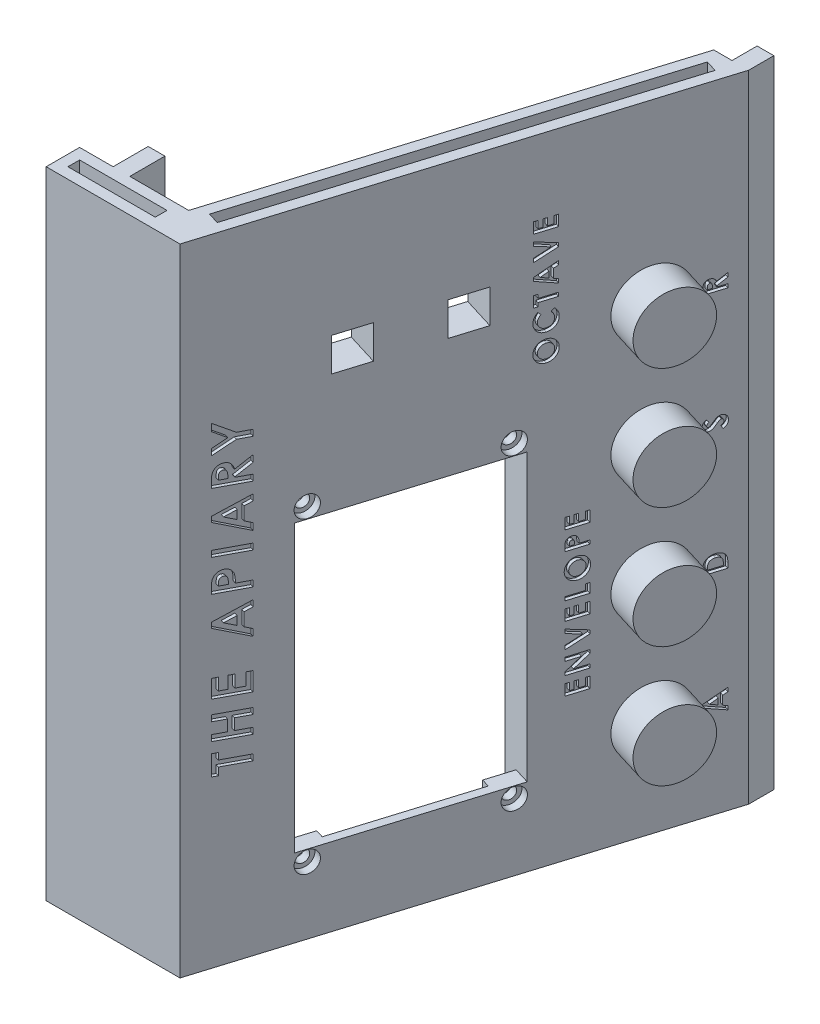
from build123d import *

# Parameters (mm, degrees)
BOSS_EXTRUDE1_DEPTH  = 190
SKETCH3_W            = 5
SKETCH3_H            = 10.5
BOSS_EXTRUDE4_DEPTH  = 190
SKETCH6_W            = 26.114253455
SKETCH6_H            = 3.5
CUT_EXTRUDE1_DEPTH   = 10
SKETCH5_W            = 98.2
SKETCH5_H            = 55.7
SKETCH5_W_2          = 98
SKETCH5_H_2          = 55.5
CUT_EXTRUDE2_DEPTH   = 5
CUT_EXTRUDE3_REACH   = 253.593
SKETCH7_R            = 1.9
LPATTERN1_COUNT      = 2
LPATTERN1_PITCH      = 92
LPATTERN1_COUNT_DIR2 = 2
LPATTERN1_PITCH_DIR2 = 49.5
CUT_EXTRUDE5_REACH   = 253.593
SKETCH9_W            = 85.4
SKETCH9_H            = 55.7
SKETCH8_W            = 6.4
SKETCH8_H            = 39.7
CUT_EXTRUDE4_DEPTH   = 2.5
SKETCH10_R           = 3.15
CUT_EXTRUDE6_DEPTH   = 2.5
LPATTERN2_COUNT      = 2
LPATTERN2_PITCH      = 92
LPATTERN2_COUNT_DIR2 = 2
LPATTERN2_PITCH_DIR2 = 49.5
CUT_EXTRUDE7_REACH   = 254.302
SKETCH11_R           = 3.35
SKETCH16_R           = 10
BOSS_EXTRUDE5_DEPTH  = 10
LPATTERN3_COUNT      = 4
LPATTERN3_PITCH      = 36.020833333
CUT_EXTRUDE9_REACH   = 254.302
SKETCH15_W           = 10
SKETCH15_H           = 10
CUT_EXTRUDE8_DEPTH   = 1


with BuildPart() as part:
    # Sketch1 → Boss-Extrude1 (new body)
    with BuildSketch(Plane(origin=(0, 0, 0), x_dir=(-1, 0, 0), z_dir=(0, 1, 0))):
        Polygon((-5.311906236, 16.03215452), (-10.311906236, 17.570616058), (-10.311906236, 10.070616058), (-5.311906236, 10.070616058), align=None)
        Polygon((-5.311906236, 17.570616058), (-10.311906236, 17.570616058), (-5.311906236, 16.03215452), align=None)
        Polygon((29.688093764, 147.570616058), (-10.311906236, 17.570616058), (-5.311906236, 17.570616058), (0.150763386, 17.570616058), (37.073840309, 137.570616058), (29.688093764, 137.570616058), align=None)
        Polygon((69.688093764, 147.570616058), (29.688093764, 147.570616058), (39.245883851, 144.62975757), (37.073840309, 137.570616058), (69.688093764, 137.570616058), align=None)
        Polygon((39.245883851, 144.62975757), (29.688093764, 147.570616058), (29.688093764, 137.570616058), (37.073840309, 137.570616058), align=None)
    extrude(amount=BOSS_EXTRUDE1_DEPTH)

    # Sketch3 → Boss-Extrude4 (add)
    with BuildSketch(Plane(origin=(0, 190, 0), x_dir=(-1, 0, 0), z_dir=(0, 1, 0))):
        with Locations((57.188093764, 132.320616058)):
            Rectangle(SKETCH3_W, SKETCH3_H)
    extrude(amount=-BOSS_EXTRUDE4_DEPTH)

    # Sketch6 → Cut-Extrude1 (cut)
    with BuildSketch(Plane(origin=(0, 190, 0), x_dir=(-1, 0, 0), z_dir=(0, 1, 0))):
        Polygon((33.011779522, 135.420113289), (-1.999739384, 21.632676846), (-5.344965914, 22.661977316), (29.666552992, 136.44941376), align=None)
        with Locations((53.380967037, 142.570616058)):
            Rectangle(SKETCH6_W, SKETCH6_H)
    cut_extrude1 = extrude(amount=-CUT_EXTRUDE1_DEPTH, mode=Mode.SUBTRACT)

    # Mirror1: Cut-Extrude1 across plane
    add(cut_extrude1.mirror(Plane.ZX.offset(95)), mode=Mode.SUBTRACT)

    # Sketch5 → Cut-Extrude2 (cut)
    # profile 1 of 2: a face of its own
    with BuildSketch(Plane(origin=(4.801043367, 0, 1.477244113), x_dir=(0, -1, 0), z_dir=(-0.9557790087219502, 0, -0.2940858488375231))):
        with Locations((-66, 94.587963377)):
            Rectangle(SKETCH5_W, SKETCH5_H)
        with Locations((-66, 94.587963377)):
            Rectangle(SKETCH5_W_2, SKETCH5_H_2, mode=Mode.SUBTRACT)
    # profile 2 of 2: a face of its own
    with BuildSketch(Plane(origin=(4.801043367, 0, 1.477244113), x_dir=(0, -1, 0), z_dir=(-0.9557790087219502, 0, -0.2940858488375231))):
        with Locations((-66, 94.587963377)):
            Rectangle(SKETCH5_W_2, SKETCH5_H_2)
    extrude(amount=-CUT_EXTRUDE2_DEPTH, mode=Mode.SUBTRACT)

    # Sketch7 → Cut-Extrude3 (cut, up to next)
    with BuildSketch(Plane(origin=(9.57993841, 0, 2.947673357), x_dir=(0, -1, 0), z_dir=(-0.9557790087219502, 0, -0.2940858488375231)), mode=Mode.PRIVATE) as cut_extrude3_sk1:
        with Locations(Location((-112, 119.337963377, 0), (0, 0, 90))):
            Circle(SKETCH7_R)
    cut_extrude3_tool1 = extrude(cut_extrude3_sk1.sketch, amount=-CUT_EXTRUDE3_REACH, mode=Mode.PRIVATE) & part.part
    cut_extrude3 = cut_extrude3_tool1.solids().sort_by_distance((-25.515668, 112, 117.008394))[0]
    add(cut_extrude3, mode=Mode.SUBTRACT)

    # LPattern1: Cut-Extrude3 2 × 2
    with Locations(*[Vector(0, -1, 0) * (i * LPATTERN1_PITCH) + Vector(0.29408584883752303, 0, -0.9557790087219501) * (j * LPATTERN1_PITCH_DIR2) for i in range(LPATTERN1_COUNT) for j in range(LPATTERN1_COUNT_DIR2) if (i, j) != (0, 0)]):
        add(cut_extrude3, mode=Mode.SUBTRACT)

    # Sketch9 → Cut-Extrude5 (cut, up to next)
    with BuildSketch(Plane(origin=(9.57993841, 0, 2.947673357), x_dir=(0, -1, 0), z_dir=(-0.9557790087219502, 0, -0.2940858488375231)), mode=Mode.PRIVATE) as cut_extrude5_sk1:
        with Locations((-66, 94.587963377)):
            Rectangle(SKETCH9_W, SKETCH9_H)
    cut_extrude5_tool1 = extrude(cut_extrude5_sk1.sketch, amount=-CUT_EXTRUDE5_REACH, mode=Mode.PRIVATE) & part.part
    add(cut_extrude5_tool1.solids().sort_by_distance((-18.237043, 66, 93.352863))[0], mode=Mode.SUBTRACT)

    # Sketch8 → Cut-Extrude4 (cut)
    with BuildSketch(Plane(origin=(9.57993841, 0, 2.947673357), x_dir=(0, -1, 0), z_dir=(-0.9557790087219502, 0, -0.2940858488375231))):
        with Locations((-20.1, 94.587963377)):
            Rectangle(SKETCH8_W, SKETCH8_H)
    extrude(amount=-CUT_EXTRUDE4_DEPTH, mode=Mode.SUBTRACT)

    # Sketch10 → Cut-Extrude6 (cut)
    with BuildSketch(Plane(origin=(14.358833454, 0, 4.418102601), x_dir=(0, 1, 0), z_dir=(0.9557790087219502, 0, 0.29408584883752303))):
        with Locations(Location((20, 119.337963377, 0), (0, 0, 270))):
            Circle(SKETCH10_R)
    cut_extrude6 = extrude(amount=-CUT_EXTRUDE6_DEPTH, mode=Mode.SUBTRACT)

    # LPattern2: Cut-Extrude6 2 × 2
    with Locations(*[Vector(0, 1, 0) * (i * LPATTERN2_PITCH) + Vector(0.29408584883752303, 0, -0.9557790087219502) * (j * LPATTERN2_PITCH_DIR2) for i in range(LPATTERN2_COUNT) for j in range(LPATTERN2_COUNT_DIR2) if (i, j) != (0, 0)]):
        add(cut_extrude6, mode=Mode.SUBTRACT)

    # Sketch11 → Cut-Extrude7 (cut, up to next)
    with BuildSketch(Plane(origin=(14.358833454, 0, 4.418102601), x_dir=(0, 1, 0), z_dir=(0.9557790087219502, 0, 0.29408584883752303)), mode=Mode.PRIVATE) as cut_extrude7_sk1:
        with Locations(Location((29.09375, 36.737963377, 0), (0, 0, 270))):
            Circle(SKETCH11_R)
    cut_extrude7_tool1 = extrude(cut_extrude7_sk1.sketch, amount=-CUT_EXTRUDE7_REACH, mode=Mode.PRIVATE) & part.part
    cut_extrude7 = cut_extrude7_tool1.solids().sort_by_distance((3.554718, 29.09375, 39.531477))[0]
    add(cut_extrude7, mode=Mode.SUBTRACT)

    # Sketch16 → Boss-Extrude5 (add)
    with BuildSketch(Plane(origin=(14.358833454, 0, 4.418102601), x_dir=(0, 1, 0), z_dir=(0.9557790087219502, 0, 0.2940858488375231))):
        with Locations(Location((29.09375, 36.737963377, 0), (0, 0, 270))):
            Circle(SKETCH16_R)
    boss_extrude5 = extrude(amount=BOSS_EXTRUDE5_DEPTH)

    # LPattern3: Cut-Extrude7, Boss-Extrude5 ×4
    with Locations(*[(0, i * LPATTERN3_PITCH, 0) for i in range(1, LPATTERN3_COUNT)]):
        add(cut_extrude7, mode=Mode.SUBTRACT)
        add(boss_extrude5)

    # Sketch15 → Cut-Extrude9 (cut, up to next)
    with BuildSketch(Plane(origin=(14.358833454, 0, 4.418102601), x_dir=(0, 1, 0), z_dir=(0.9557790087219502, 0, 0.2940858488375231)), mode=Mode.PRIVATE) as cut_extrude9_sk1:
        with Locations((149.35, 108.512963377)):
            Rectangle(SKETCH15_W, SKETCH15_H)
    cut_extrude9_tool1 = extrude(cut_extrude9_sk1.sketch, amount=-CUT_EXTRUDE9_REACH, mode=Mode.PRIVATE) & part.part
    # Sketch15 → Cut-Extrude9 (cut, up to next)
    with BuildSketch(Plane(origin=(14.358833454, 0, 4.418102601), x_dir=(0, 1, 0), z_dir=(0.9557790087219502, 0, 0.2940858488375231)), mode=Mode.PRIVATE) as cut_extrude9_sk2:
        with Locations((149.35, 80.662963377)):
            Rectangle(SKETCH15_W, SKETCH15_H)
    cut_extrude9_tool2 = extrude(cut_extrude9_sk2.sketch, amount=-CUT_EXTRUDE9_REACH, mode=Mode.PRIVATE) & part.part
    add(cut_extrude9_tool1.solids().sort_by_distance((-17.553293, 149.35, 108.132515))[0], mode=Mode.SUBTRACT)
    add(cut_extrude9_tool2.solids().sort_by_distance((-9.363003, 149.35, 81.51407))[0], mode=Mode.SUBTRACT)

    # Sketch13 → Cut-Extrude8 (cut)
    # profile 1 of 27: a face of its own
    with BuildSketch(Plane(origin=(14.358833454, 0, 4.418102601), x_dir=(0, 1, 0), z_dir=(0.9557790087219502, 0, 0.2940858488375231))):
        Polygon((42.484615385, 57.737963377), (45.715384615, 57.737963377), (45.715384615, 56.6610403), (43.561538462, 56.6610403), (43.561538462, 55.507194147), (45.715384615, 55.507194147), (45.715384615, 54.43027107), (43.561538462, 54.43027107), (43.561538462, 52.814886454), (45.715384615, 52.814886454), (45.715384615, 51.737963377), (42.484615385, 51.737963377), align=None)
    # profile 2 of 27: a face of its own
    with BuildSketch(Plane(origin=(14.358833454, 0, 4.418102601), x_dir=(0, 1, 0), z_dir=(0.9557790087219502, 0, 0.2940858488375231))):
        Polygon((47.807692308, 57.737963377), (48.777644231, 57.737963377), (51.5, 53.78964607), (51.5, 57.737963377), (52.576923077, 57.737963377), (52.576923077, 51.737963377), (51.599759615, 51.737963377), (48.884615385, 55.674261454), (48.884615385, 51.737963377), (47.807692308, 51.737963377), align=None)
    # profile 3 of 27: a face of its own
    with BuildSketch(Plane(origin=(14.358833454, 0, 4.418102601), x_dir=(0, 1, 0), z_dir=(0.9557790087219502, 0, 0.2940858488375231))):
        Polygon((54.476923077, 57.737963377), (55.627163462, 57.737963377), (57.169230769, 53.475944147), (58.7125, 57.737963377), (59.861538462, 57.737963377), (57.687259615, 51.737963377), (56.648798077, 51.737963377), align=None)
    # profile 4 of 27: a face of its own
    with BuildSketch(Plane(origin=(14.358833454, 0, 4.418102601), x_dir=(0, 1, 0), z_dir=(0.9557790087219502, 0, 0.2940858488375231))):
        Polygon((61.838461538, 57.737963377), (65.069230769, 57.737963377), (65.069230769, 56.6610403), (62.915384615, 56.6610403), (62.915384615, 55.507194147), (65.069230769, 55.507194147), (65.069230769, 54.43027107), (62.915384615, 54.43027107), (62.915384615, 52.814886454), (65.069230769, 52.814886454), (65.069230769, 51.737963377), (61.838461538, 51.737963377), align=None)
    # profile 5 of 27: a face of its own
    with BuildSketch(Plane(origin=(14.358833454, 0, 4.418102601), x_dir=(0, 1, 0), z_dir=(0.9557790087219502, 0, 0.2940858488375231))):
        Polygon((67.161538462, 57.737963377), (68.238461538, 57.737963377), (68.238461538, 52.814886454), (69.930769231, 52.814886454), (69.930769231, 51.737963377), (67.161538462, 51.737963377), align=None)
    # profile 6 of 27: a face of its own
    with BuildSketch(Plane(origin=(14.358833454, 0, 4.418102601), x_dir=(0, 1, 0), z_dir=(0.9557790087219502, 0, 0.2940858488375231))):
        with BuildLine():
            add(Edge.make_bspline(
                [(74.688942308, 57.891809531), (74.793259661, 57.889108568), (74.999205744, 57.883776255), (75.302078114, 57.839327266), (75.593951643, 57.766904009), (75.874694347, 57.666230445), (76.143603279, 57.53457982), (76.401626971, 57.375684517), (76.647841193, 57.186545482), (76.879722939, 56.971575017), (77.094023494, 56.737804022), (77.27971505, 56.486107985), (77.438065997, 56.223008604), (77.569307685, 55.947800894), (77.669272659, 55.658578912), (77.739422216, 55.356817308), (77.784489831, 55.04260193), (77.7896733, 54.828664085), (77.792307692, 54.719934531)],
                knots=[0, 0, 0, 0, 1.014329547, 2.002516266, 2.970391464, 3.935626869, 4.897733899, 5.877609409, 6.878433252, 7.912639331, 8.949961323, 9.958554974, 10.949718813, 11.932905612, 12.9188844, 13.919928257, 14.942845884, 16, 16, 16, 16], degree=3))
            add(Edge.make_bspline(
                [(77.792307692, 54.719934531), (77.789502178, 54.612430108), (77.783973822, 54.400589193), (77.741262073, 54.089269434), (77.669931189, 53.790740325), (77.5716617, 53.50432614), (77.442800239, 53.23141417), (77.287537309, 52.970261912), (77.101775814, 52.723292919), (76.892291206, 52.490639726), (76.661666833, 52.279457031), (76.41739901, 52.093352646), (76.160615616, 51.935654814), (75.8916925, 51.806435766), (75.610052969, 51.706153623), (75.316392707, 51.635397283), (75.010729885, 51.592397227), (74.802864343, 51.586904982), (74.697355769, 51.584117224)],
                knots=[0, 0, 0, 0, 1.051557043, 2.072126891, 3.067553643, 4.050577992, 5.02905126, 6.015227836, 7.017913613, 8.04756643, 9.074058332, 10.072836633, 11.047628519, 12.017157415, 12.98668631, 13.966869689, 14.968021931, 16, 16, 16, 16], degree=3))
            add(Edge.make_bspline(
                [(74.697355769, 51.584117224), (74.587006452, 51.58661798), (74.370185126, 51.591531626), (74.052866145, 51.63825815), (73.748847143, 51.708644619), (73.460682054, 51.813692648), (73.185436163, 51.945011517), (72.925131782, 52.106738577), (72.679856392, 52.298606562), (72.451016931, 52.515701662), (72.243687825, 52.753251317), (72.060679221, 53.004201462), (71.906307404, 53.266635058), (71.780566726, 53.54067493), (71.681437826, 53.824617987), (71.61151365, 54.120193524), (71.570207771, 54.426692644), (71.564454102, 54.634872973), (71.561538462, 54.740367224)],
                knots=[0, 0, 0, 0, 1.067978421, 2.098431617, 3.099715153, 4.085208694, 5.062210972, 6.048429807, 7.046490867, 8.072918869, 9.098532598, 10.095778865, 11.076610158, 12.041847152, 13.011192615, 13.984257998, 14.978533688, 16, 16, 16, 16], degree=3))
            add(Edge.make_bspline(
                [(71.561538462, 54.740367224), (71.562453558, 54.811338233), (71.564272162, 54.952381596), (71.586179172, 55.161400661), (71.617718968, 55.366339954), (71.664364829, 55.566382379), (71.721027628, 55.762939144), (71.794442289, 55.954180648), (71.878008041, 56.142149877), (71.975646754, 56.324626679), (72.084211561, 56.499932116), (72.202665433, 56.667239239), (72.331306218, 56.824525063), (72.469719522, 56.972823204), (72.618382337, 57.111158889), (72.775339156, 57.241490451), (72.943634029, 57.36035582), (73.119583508, 57.470657926), (73.30219563, 57.570402208), (73.490726999, 57.655301558), (73.681293496, 57.729442714), (73.876440832, 57.787958192), (74.074077657, 57.835618437), (74.276315319, 57.867136975), (74.481326717, 57.889043378), (74.619572873, 57.890885292), (74.688942308, 57.891809531)],
                knots=[0, 0, 0, 0, 1.034744296, 2.056386356, 3.06226378, 4.057406941, 5.050368692, 6.043467995, 7.042652155, 8.049140477, 9.059438543, 10.048523776, 11.036952808, 12.020949711, 13.004946614, 13.997082645, 14.994316842, 16.007702937, 17.024872941, 18.026463647, 19.021641123, 20.005082605, 20.995858141, 21.984425357, 22.988620895, 24, 24, 24, 24], degree=3))
        make_face()
        with BuildLine():
            add(Edge.make_bspline(
                [(74.672115385, 56.814886454), (74.60190982, 56.813002681), (74.463352128, 56.809284867), (74.260113228, 56.780960153), (74.064996706, 56.735722366), (73.879084172, 56.670195983), (73.701569862, 56.586797528), (73.532139101, 56.485818406), (73.373138153, 56.363787572), (73.222446894, 56.227256318), (73.086322138, 56.075129124), (72.966051622, 55.912098963), (72.865404572, 55.738438094), (72.781112037, 55.555759784), (72.71765844, 55.362009865), (72.672462346, 55.158706001), (72.643900101, 54.945497889), (72.640299794, 54.800154196), (72.638461538, 54.725944147)],
                knots=[0, 0, 0, 0, 1.033739768, 2.040188636, 3.016340934, 3.979330865, 4.937572243, 5.900995986, 6.878200029, 7.884839167, 8.891893314, 9.879764717, 10.863503415, 11.843163062, 12.837761627, 13.859916423, 14.907309254, 16, 16, 16, 16], degree=3))
            add(Edge.make_bspline(
                [(72.638461538, 54.725944147), (72.640898785, 54.643702719), (72.645675385, 54.482523146), (72.679284124, 54.247398729), (72.736785329, 54.025347053), (72.819815953, 53.817454139), (72.922795709, 53.621411494), (73.050680222, 53.439621897), (73.201398368, 53.270996878), (73.317510407, 53.172546568), (73.376442308, 53.122578762)],
                knots=[0, 0, 0, 0, 1.078454662, 2.113592447, 3.107694534, 4.079536787, 5.043276885, 6.005368276, 6.987637804, 8, 8, 8, 8], degree=3))
            add(Edge.make_bspline(
                [(73.376442308, 53.122578762), (73.424718785, 53.085664466), (73.520184063, 53.012667559), (73.672567431, 52.919107047), (73.829492294, 52.838916356), (73.992142847, 52.774123226), (74.16017558, 52.723158039), (74.333567452, 52.687467957), (74.512072781, 52.665069343), (74.63278645, 52.662392285), (74.69375, 52.6610403)],
                knots=[0, 0, 0, 0, 1.023928204, 2.024787132, 3.009472467, 3.9914905, 4.972207045, 5.96565515, 6.972602802, 8, 8, 8, 8], degree=3))
            add(Edge.make_bspline(
                [(74.69375, 52.6610403), (74.762748379, 52.662940046), (74.898504859, 52.666677854), (75.097960357, 52.694653875), (75.289044782, 52.741999404), (75.472944402, 52.806950966), (75.649128934, 52.89139656), (75.816737315, 52.995507738), (75.976063407, 53.118006148), (76.126562687, 53.256330357), (76.264126144, 53.409056827), (76.38414568, 53.572956574), (76.487992803, 53.744418395), (76.570532474, 53.925869072), (76.636492979, 54.115595797), (76.681145115, 54.314438827), (76.709948646, 54.521578457), (76.713549967, 54.662544295), (76.715384615, 54.734357608)],
                knots=[0, 0, 0, 0, 1.026359118, 2.019393844, 2.989460624, 3.950973911, 4.916101784, 5.890408035, 6.881132271, 7.902007068, 8.92769091, 9.933912415, 10.920395702, 11.90457117, 12.894218921, 13.903490204, 14.931958862, 16, 16, 16, 16], degree=3))
            add(Edge.make_bspline(
                [(76.715384615, 54.734357608), (76.713486488, 54.805757975), (76.709750313, 54.946298707), (76.681725052, 55.152905783), (76.634679777, 55.350870979), (76.569533172, 55.540517596), (76.486344407, 55.722031556), (76.38347306, 55.894774549), (76.261280095, 56.058579575), (76.122577773, 56.212330366), (75.97160882, 56.353617494), (75.809528565, 56.476229038), (75.640872195, 56.582774571), (75.46176991, 56.66623804), (75.275885992, 56.732733208), (75.082086168, 56.781701204), (74.87963641, 56.809085885), (74.741905653, 56.812935696), (74.672115385, 56.814886454)],
                knots=[0, 0, 0, 0, 1.055025985, 2.07665775, 3.074803781, 4.057872707, 5.035505728, 6.020516407, 7.023567878, 8.050795229, 9.077271434, 10.074415901, 11.050397877, 12.019801805, 12.988065821, 13.964604439, 14.968634123, 16, 16, 16, 16], degree=3))
        make_face(mode=Mode.SUBTRACT)
    # profile 7 of 27: a face of its own
    with BuildSketch(Plane(origin=(14.358833454, 0, 4.418102601), x_dir=(0, 1, 0), z_dir=(0.9557790087219502, 0, 0.2940858488375231))):
        with BuildLine():
            Line((79.884615385, 57.737963377), (81.086538462, 57.737963377))
            add(Edge.make_bspline(
                [(81.086538462, 57.737963377), (81.165070556, 57.737611851), (81.316575428, 57.736933683), (81.535057918, 57.728709993), (81.736618713, 57.71397264), (81.921211503, 57.695759603), (82.08876039, 57.670225633), (82.239475195, 57.640952935), (82.373387195, 57.60529027), (82.492006446, 57.562959181), (82.598463392, 57.51305248), (82.699205999, 57.459898282), (82.791957472, 57.396460621), (82.881399258, 57.329576539), (82.962417817, 57.252856626), (83.040067571, 57.171406702), (83.11105984, 57.081996532), (83.175723578, 56.9857084), (83.234383552, 56.884321301), (83.28563283, 56.777653983), (83.327203374, 56.665537657), (83.362075891, 56.548697589), (83.390085837, 56.42713887), (83.408730148, 56.300113903), (83.421394303, 56.168509626), (83.422511739, 56.078939671), (83.423076923, 56.033636454)],
                knots=[0, 0, 0, 0, 1.698747864, 3.27724071, 4.728299578, 6.070144658, 7.288476769, 8.393259625, 9.389771311, 10.283485332, 11.113357557, 11.931608583, 12.74405601, 13.541433047, 14.344816069, 15.154114104, 15.974336324, 16.810834471, 17.661136416, 18.50621059, 19.367396281, 20.244825668, 21.142564693, 22.063065223, 23.020325768, 24, 24, 24, 24], degree=3))
            add(Edge.make_bspline(
                [(83.423076923, 56.033636454), (83.422259173, 55.983518584), (83.420652194, 55.88503081), (83.404898617, 55.740659817), (83.377986531, 55.603015146), (83.342813842, 55.470936016), (83.293768029, 55.34659542), (83.237735491, 55.227026554), (83.168797696, 55.115581762), (83.090025244, 55.010867003), (83.00399674, 54.912030898), (82.908669871, 54.821927152), (82.805861607, 54.739941531), (82.69616707, 54.665214818), (82.579174432, 54.597897756), (82.454968111, 54.53735999), (82.322699954, 54.485537706), (82.230592389, 54.458435071), (82.183894231, 54.444694147)],
                knots=[0, 0, 0, 0, 1.102006807, 2.165578795, 3.188629044, 4.184801286, 5.166646146, 6.124351954, 7.085497154, 8.042432466, 9.003981491, 9.963833307, 10.922997304, 11.89326795, 12.880200226, 13.889073926, 14.929769137, 16, 16, 16, 16], degree=3))
            add(Edge.make_bspline(
                [(82.183894231, 54.444694147), (82.153136138, 54.437041483), (82.086504204, 54.42046335), (81.976246654, 54.403632384), (81.849186405, 54.388157346), (81.704912587, 54.374858424), (81.543342023, 54.365818256), (81.364631155, 54.358758286), (81.168698996, 54.353624959), (81.03245552, 54.353442806), (80.961538462, 54.353347993)],
                knots=[0, 0, 0, 0, 0.618981996, 1.340914327, 2.176866532, 3.120127938, 4.170906482, 5.338178032, 6.614476169, 8, 8, 8, 8], degree=3))
            Line((80.961538462, 54.353347993), (80.961538462, 51.737963377))
            Line((80.961538462, 51.737963377), (79.884615385, 51.737963377))
            Line((79.884615385, 51.737963377), (79.884615385, 57.737963377))
        make_face()
        with BuildLine():
            Line((80.961538462, 55.43027107), (81.342548077, 55.43027107))
            add(Edge.make_bspline(
                [(81.342548077, 55.43027107), (81.411878792, 55.43071068), (81.539448337, 55.43151957), (81.713663287, 55.443216589), (81.853665772, 55.461080299), (81.964270334, 55.48670099), (82.051603113, 55.525583782), (82.126922167, 55.570563851), (82.191525242, 55.627439912), (82.247461996, 55.692430544), (82.292181746, 55.767108038), (82.323192563, 55.850256415), (82.34333658, 55.940128639), (82.345197067, 56.002673759), (82.346153846, 56.034838377)],
                knots=[0, 0, 0, 0, 1.8619151, 3.425951444, 4.686033666, 5.651700536, 6.461346321, 7.243864085, 7.999046032, 8.762387399, 9.539336099, 10.322741239, 11.137448474, 12, 12, 12, 12], degree=3))
            add(Edge.make_bspline(
                [(82.346153846, 56.034838377), (82.345206909, 56.062940186), (82.343369623, 56.117464451), (82.329872421, 56.196156489), (82.308361763, 56.269513702), (82.277193646, 56.336769972), (82.236900652, 56.397811017), (82.187775338, 56.452612794), (82.130448078, 56.502348927), (82.086188082, 56.528675022), (82.063701923, 56.542049916)],
                knots=[0, 0, 0, 0, 1.102301479, 2.1387299, 3.123554645, 4.094223062, 5.036071848, 5.982632524, 6.975082478, 8, 8, 8, 8], degree=3))
            add(Edge.make_bspline(
                [(82.063701923, 56.542049916), (82.044654849, 56.551682568), (82.004328289, 56.572076865), (81.935648247, 56.595786728), (81.856392528, 56.615788608), (81.766026066, 56.632389976), (81.664909359, 56.645274362), (81.553060447, 56.655127694), (81.430314735, 56.659090102), (81.344952437, 56.660372304), (81.300480769, 56.6610403)],
                knots=[0, 0, 0, 0, 0.656809284, 1.390599849, 2.23162475, 3.173112763, 4.218524733, 5.370385145, 6.63003504, 8, 8, 8, 8], degree=3))
            Line((81.300480769, 56.6610403), (80.961538462, 56.6610403))
            Line((80.961538462, 56.6610403), (80.961538462, 55.43027107))
        make_face(mode=Mode.SUBTRACT)
    # profile 8 of 27: a face of its own
    with BuildSketch(Plane(origin=(14.358833454, 0, 4.418102601), x_dir=(0, 1, 0), z_dir=(0.9557790087219502, 0, 0.2940858488375231))):
        Polygon((85.515384615, 57.737963377), (88.746153846, 57.737963377), (88.746153846, 56.6610403), (86.592307692, 56.6610403), (86.592307692, 55.507194147), (88.746153846, 55.507194147), (88.746153846, 54.43027107), (86.592307692, 54.43027107), (86.592307692, 52.814886454), (88.746153846, 52.814886454), (88.746153846, 51.737963377), (85.515384615, 51.737963377), align=None)
    # profile 9 of 27: a face of its own
    with BuildSketch(Plane(origin=(14.358833454, 0, 4.418102601), x_dir=(0, 1, 0), z_dir=(0.9557790087219502, 0, 0.2940858488375231))):
        with BuildLine():
            add(Edge.make_bspline(
                [(133.362019231, 65.391809531), (133.466336584, 65.389108568), (133.672282667, 65.383776255), (133.975155037, 65.339327266), (134.267028566, 65.266904009), (134.54777127, 65.166230445), (134.816680202, 65.03457982), (135.074703894, 64.875684517), (135.320918116, 64.686545482), (135.552799863, 64.471575017), (135.767100417, 64.237804022), (135.952791973, 63.986107985), (136.11114292, 63.723008604), (136.242384608, 63.447800894), (136.342349582, 63.158578912), (136.412499139, 62.856817308), (136.457566754, 62.54260193), (136.462750223, 62.328664085), (136.465384615, 62.219934531)],
                knots=[0, 0, 0, 0, 1.014329547, 2.002516266, 2.970391464, 3.935626869, 4.897733899, 5.877609409, 6.878433252, 7.912639331, 8.949961323, 9.958554974, 10.949718813, 11.932905612, 12.9188844, 13.919928257, 14.942845884, 16, 16, 16, 16], degree=3))
            add(Edge.make_bspline(
                [(136.465384615, 62.219934531), (136.462579101, 62.112430108), (136.457050745, 61.900589193), (136.414338996, 61.589269434), (136.343008112, 61.290740325), (136.244738623, 61.00432614), (136.115877162, 60.73141417), (135.960614232, 60.470261912), (135.774852737, 60.223292919), (135.565368129, 59.990639726), (135.334743756, 59.779457031), (135.090475933, 59.593352646), (134.833692539, 59.435654814), (134.564769423, 59.306435766), (134.283129892, 59.206153623), (133.98946963, 59.135397283), (133.683806808, 59.092397227), (133.475941267, 59.086904982), (133.370432692, 59.084117224)],
                knots=[0, 0, 0, 0, 1.051557043, 2.072126891, 3.067553643, 4.050577992, 5.02905126, 6.015227836, 7.017913613, 8.04756643, 9.074058332, 10.072836633, 11.047628519, 12.017157415, 12.98668631, 13.966869689, 14.968021931, 16, 16, 16, 16], degree=3))
            add(Edge.make_bspline(
                [(133.370432692, 59.084117224), (133.260083375, 59.08661798), (133.043262049, 59.091531626), (132.725943068, 59.13825815), (132.421924066, 59.208644619), (132.133758977, 59.313692648), (131.858513086, 59.445011517), (131.598208705, 59.606738577), (131.352933315, 59.798606562), (131.124093854, 60.015701662), (130.916764748, 60.253251317), (130.733756144, 60.504201462), (130.579384327, 60.766635058), (130.453643649, 61.04067493), (130.354514749, 61.324617987), (130.284590574, 61.620193524), (130.243284694, 61.926692644), (130.237531025, 62.134872973), (130.234615385, 62.240367224)],
                knots=[0, 0, 0, 0, 1.067978421, 2.098431617, 3.099715153, 4.085208694, 5.062210972, 6.048429807, 7.046490867, 8.072918869, 9.098532598, 10.095778865, 11.076610158, 12.041847152, 13.011192615, 13.984257998, 14.978533688, 16, 16, 16, 16], degree=3))
            add(Edge.make_bspline(
                [(130.234615385, 62.240367224), (130.235530481, 62.311338233), (130.237349085, 62.452381596), (130.259256095, 62.661400661), (130.290795891, 62.866339954), (130.337441752, 63.066382379), (130.394104552, 63.262939144), (130.467519212, 63.454180648), (130.551084964, 63.642149877), (130.648723677, 63.824626679), (130.757288484, 63.999932116), (130.875742356, 64.167239239), (131.004383141, 64.324525063), (131.142796445, 64.472823204), (131.29145926, 64.611158889), (131.44841608, 64.741490451), (131.616710952, 64.86035582), (131.792660431, 64.970657926), (131.975272553, 65.070402208), (132.163803922, 65.155301558), (132.354370419, 65.229442714), (132.549517755, 65.287958192), (132.74715458, 65.335618437), (132.949392242, 65.367136975), (133.15440364, 65.389043378), (133.292649796, 65.390885292), (133.362019231, 65.391809531)],
                knots=[0, 0, 0, 0, 1.034744296, 2.056386356, 3.06226378, 4.057406941, 5.050368692, 6.043467995, 7.042652155, 8.049140477, 9.059438543, 10.048523776, 11.036952808, 12.020949711, 13.004946614, 13.997082645, 14.994316842, 16.007702937, 17.024872941, 18.026463647, 19.021641123, 20.005082605, 20.995858141, 21.984425357, 22.988620895, 24, 24, 24, 24], degree=3))
        make_face()
        with BuildLine():
            add(Edge.make_bspline(
                [(133.345192308, 64.314886454), (133.274986743, 64.313002681), (133.136429051, 64.309284867), (132.933190151, 64.280960153), (132.73807363, 64.235722366), (132.552161095, 64.170195983), (132.374646785, 64.086797528), (132.205216024, 63.985818406), (132.046215076, 63.863787572), (131.895523817, 63.727256318), (131.759399061, 63.575129124), (131.639128545, 63.412098963), (131.538481495, 63.238438094), (131.45418896, 63.055759784), (131.390735363, 62.862009865), (131.345539269, 62.658706001), (131.316977024, 62.445497889), (131.313376718, 62.300154196), (131.311538462, 62.225944147)],
                knots=[0, 0, 0, 0, 1.033739768, 2.040188636, 3.016340934, 3.979330865, 4.937572243, 5.900995986, 6.878200029, 7.884839167, 8.891893314, 9.879764717, 10.863503415, 11.843163062, 12.837761627, 13.859916423, 14.907309254, 16, 16, 16, 16], degree=3))
            add(Edge.make_bspline(
                [(131.311538462, 62.225944147), (131.313975708, 62.143702719), (131.318752308, 61.982523146), (131.352361047, 61.747398729), (131.409862252, 61.525347053), (131.492892876, 61.317454139), (131.595872632, 61.121411494), (131.723757145, 60.939621897), (131.874475291, 60.770996878), (131.99058733, 60.672546568), (132.049519231, 60.622578762)],
                knots=[0, 0, 0, 0, 1.078454662, 2.113592447, 3.107694534, 4.079536787, 5.043276885, 6.005368276, 6.987637804, 8, 8, 8, 8], degree=3))
            add(Edge.make_bspline(
                [(132.049519231, 60.622578762), (132.097795708, 60.585664466), (132.193260986, 60.512667559), (132.345644354, 60.419107047), (132.502569217, 60.338916356), (132.66521977, 60.274123226), (132.833252504, 60.223158039), (133.006644375, 60.187467957), (133.185149704, 60.165069343), (133.305863373, 60.162392285), (133.366826923, 60.1610403)],
                knots=[0, 0, 0, 0, 1.023928204, 2.024787132, 3.009472467, 3.9914905, 4.972207045, 5.96565515, 6.972602802, 8, 8, 8, 8], degree=3))
            add(Edge.make_bspline(
                [(133.366826923, 60.1610403), (133.435825302, 60.162940046), (133.571581782, 60.166677854), (133.77103728, 60.194653875), (133.962121705, 60.241999404), (134.146021325, 60.306950966), (134.322205857, 60.39139656), (134.489814238, 60.495507738), (134.649140331, 60.618006148), (134.799639611, 60.756330357), (134.937203067, 60.909056827), (135.057222603, 61.072956574), (135.161069726, 61.244418395), (135.243609397, 61.425869072), (135.309569902, 61.615595797), (135.354222038, 61.814438827), (135.383025569, 62.021578457), (135.38662689, 62.162544295), (135.388461538, 62.234357608)],
                knots=[0, 0, 0, 0, 1.026359118, 2.019393844, 2.989460624, 3.950973911, 4.916101784, 5.890408035, 6.881132271, 7.902007068, 8.92769091, 9.933912415, 10.920395702, 11.90457117, 12.894218921, 13.903490204, 14.931958862, 16, 16, 16, 16], degree=3))
            add(Edge.make_bspline(
                [(135.388461538, 62.234357608), (135.386563411, 62.305757975), (135.382827236, 62.446298707), (135.354801975, 62.652905783), (135.3077567, 62.850870979), (135.242610095, 63.040517596), (135.15942133, 63.222031556), (135.056549984, 63.394774549), (134.934357018, 63.558579575), (134.795654696, 63.712330366), (134.644685743, 63.853617494), (134.482605488, 63.976229038), (134.313949118, 64.082774571), (134.134846833, 64.16623804), (133.948962915, 64.232733208), (133.755163091, 64.281701204), (133.552713333, 64.309085885), (133.414982576, 64.312935696), (133.345192308, 64.314886454)],
                knots=[0, 0, 0, 0, 1.055025985, 2.07665775, 3.074803781, 4.057872707, 5.035505728, 6.020516407, 7.023567878, 8.050795229, 9.077271434, 10.074415901, 11.050397877, 12.019801805, 12.988065821, 13.964604439, 14.968634123, 16, 16, 16, 16], degree=3))
        make_face(mode=Mode.SUBTRACT)
    # profile 10 of 27: a face of its own
    with BuildSketch(Plane(origin=(14.358833454, 0, 4.418102601), x_dir=(0, 1, 0), z_dir=(0.9557790087219502, 0, 0.2940858488375231))):
        with BuildLine():
            Line((143.942307692, 64.197097993), (143.152644231, 63.4422903))
            add(Edge.make_bspline(
                [(143.152644231, 63.4422903), (143.085658543, 63.511553614), (142.954814508, 63.646846565), (142.743975528, 63.82596251), (142.524710666, 63.975231414), (142.301285281, 64.100944735), (142.069680599, 64.196055822), (141.832574601, 64.265364873), (141.588453295, 64.307619982), (141.423241384, 64.312454714), (141.340144231, 64.314886454)],
                knots=[0, 0, 0, 0, 1.115251505, 2.178435587, 3.19620269, 4.182487026, 5.141301733, 6.088180966, 7.038406374, 8, 8, 8, 8], degree=3))
            add(Edge.make_bspline(
                [(141.340144231, 64.314886454), (141.270748009, 64.312965294), (141.133802212, 64.309174097), (140.932729895, 64.281380879), (140.740393832, 64.234117304), (140.556135626, 64.168979341), (140.380497466, 64.084694275), (140.213111103, 63.98132734), (140.054389222, 63.859812085), (139.906428448, 63.720777238), (139.771079131, 63.568871219), (139.651489391, 63.406787859), (139.551313801, 63.234898482), (139.469101323, 63.054943857), (139.405060981, 62.866091066), (139.359328131, 62.668467251), (139.332877473, 62.461837057), (139.328929535, 62.321371392), (139.326923077, 62.249982608)],
                knots=[0, 0, 0, 0, 1.035432265, 2.043311493, 3.022114605, 3.98653278, 4.95457646, 5.923598177, 6.917315552, 7.932509744, 8.948865224, 9.949768934, 10.933144597, 11.912367597, 12.897413939, 13.903909035, 14.934704909, 16, 16, 16, 16], degree=3))
            add(Edge.make_bspline(
                [(139.326923077, 62.249982608), (139.327501315, 62.199876965), (139.328641035, 62.101117713), (139.341117283, 61.955025369), (139.361206984, 61.813281258), (139.390281759, 61.676100084), (139.426640051, 61.543362964), (139.469296606, 61.413924782), (139.522808627, 61.289574083), (139.582207777, 61.168866614), (139.651288305, 61.055096029), (139.725769857, 60.946606334), (139.80653294, 60.843929335), (139.894100661, 60.747484778), (139.989705427, 60.658779876), (140.090876209, 60.575147167), (140.199319616, 60.498680261), (140.312783006, 60.427460137), (140.432246558, 60.365590609), (140.554468949, 60.309548769), (140.681303317, 60.264034463), (140.811205377, 60.227345781), (140.943710906, 60.196147535), (141.08011593, 60.176937817), (141.219237988, 60.162390522), (141.313261148, 60.161492312), (141.360576923, 60.1610403)],
                knots=[0, 0, 0, 0, 1.103660481, 2.175337485, 3.227646561, 4.255952547, 5.262355991, 6.258840057, 7.255597736, 8.242457506, 9.22035537, 10.185017736, 11.140346927, 12.096287581, 13.051739095, 14.01125915, 14.986044842, 15.97314143, 16.960198552, 17.947847494, 18.933482797, 19.925264591, 20.920966487, 21.929612487, 22.958107872, 24, 24, 24, 24], degree=3))
            add(Edge.make_bspline(
                [(141.360576923, 60.1610403), (141.440832609, 60.163361721), (141.598514163, 60.167922708), (141.829934516, 60.203588983), (142.050455057, 60.262257987), (142.226649914, 60.331542671), (142.36469393, 60.399962197), (142.469784799, 60.463246889), (142.578456948, 60.534037764), (142.688905426, 60.615006549), (142.80237256, 60.705181584), (142.916855392, 60.806537872), (143.035284703, 60.915737894), (143.112866571, 60.993676096), (143.152644231, 61.033636454)],
                knots=[0, 0, 0, 0, 1.404581149, 2.759636711, 4.088442092, 5.392261763, 6.066678138, 6.783632037, 7.538459478, 8.336747902, 9.180226004, 10.074962426, 11.012997595, 12, 12, 12, 12], degree=3))
            Line((143.152644231, 61.033636454), (143.918269231, 60.229549916))
            add(Edge.make_bspline(
                [(143.918269231, 60.229549916), (143.864449914, 60.177589055), (143.759406118, 60.076172568), (143.600950468, 59.93217062), (143.44269424, 59.802768861), (143.288460576, 59.683270575), (143.135722967, 59.577157038), (142.984497611, 59.484322272), (142.836496445, 59.402418351), (142.688646177, 59.332826547), (142.540026806, 59.273735877), (142.387114939, 59.222862688), (142.22944311, 59.179825801), (142.06604833, 59.145100685), (141.898454647, 59.11725583), (141.725093607, 59.098460714), (141.547064404, 59.085825383), (141.426304437, 59.084689994), (141.365384615, 59.084117224)],
                knots=[0, 0, 0, 0, 1.244526981, 2.429050516, 3.560637417, 4.644440555, 5.67424972, 6.652764056, 7.595344123, 8.486817594, 9.369275933, 10.254498637, 11.166417451, 12.086725134, 13.032340136, 13.991389299, 14.986715468, 16, 16, 16, 16], degree=3))
            add(Edge.make_bspline(
                [(141.365384615, 59.084117224), (141.253482449, 59.086969833), (141.034521013, 59.092551597), (140.713638739, 59.133908686), (140.408809192, 59.203243118), (140.119290779, 59.301301129), (139.84517556, 59.426565642), (139.586533663, 59.580134053), (139.34378196, 59.761598355), (139.118881407, 59.968831611), (138.915448154, 60.197703344), (138.735636716, 60.443448797), (138.586896689, 60.707275719), (138.463394639, 60.985286542), (138.36681766, 61.278749939), (138.298843839, 61.587983347), (138.25692488, 61.912688183), (138.252338887, 62.134469071), (138.25, 62.247578762)],
                knots=[0, 0, 0, 0, 1.078019885, 2.10938526, 3.111377082, 4.085535484, 5.04941344, 6.010039228, 6.978205633, 7.964457913, 8.951525778, 9.924444315, 10.892603023, 11.863865945, 12.85144698, 13.863884204, 14.910567087, 16, 16, 16, 16], degree=3))
            add(Edge.make_bspline(
                [(138.25, 62.247578762), (138.2509883, 62.321347938), (138.252946869, 62.467540414), (138.273531613, 62.682893776), (138.302227944, 62.892824784), (138.347752062, 63.095153656), (138.402626897, 63.292606138), (138.470870964, 63.48303615), (138.552375267, 63.666991008), (138.644512732, 63.844778664), (138.748746924, 64.015234417), (138.865187959, 64.176893784), (138.990838192, 64.331004746), (139.128716791, 64.475522735), (139.276820201, 64.611716647), (139.435817092, 64.73884842), (139.604751177, 64.858741268), (139.784079696, 64.968303446), (139.970318776, 65.067408259), (140.161119452, 65.154822936), (140.356012947, 65.227881477), (140.554175235, 65.288480841), (140.756443549, 65.333713982), (140.961374149, 65.36795401), (141.170710748, 65.387094405), (141.311262139, 65.39022781), (141.382211538, 65.391809531)],
                knots=[0, 0, 0, 0, 1.071919942, 2.124283339, 3.142214191, 4.149696895, 5.136002878, 6.119640489, 7.086990633, 8.058538607, 9.028339693, 9.988281803, 10.952401235, 11.916291999, 12.888973767, 13.874849856, 14.873389453, 15.898127285, 16.927174885, 17.938320013, 18.946391617, 19.950418109, 20.947802303, 21.956882652, 22.968648068, 24, 24, 24, 24], degree=3))
            add(Edge.make_bspline(
                [(141.382211538, 65.391809531), (141.442738651, 65.390902849), (141.563163562, 65.389098911), (141.742496463, 65.374061127), (141.920395144, 65.35044444), (142.096222672, 65.314811889), (142.271236746, 65.272511547), (142.443137484, 65.217125085), (142.614636715, 65.155386435), (142.783044726, 65.081590485), (142.948596592, 65.00103554), (143.107413998, 64.909643029), (143.262163475, 64.813037146), (143.409415866, 64.705500331), (143.551929527, 64.590933144), (143.68895924, 64.468801065), (143.819302491, 64.337067794), (143.901098678, 64.243990462), (143.942307692, 64.197097993)],
                knots=[0, 0, 0, 0, 0.996412454, 1.982464992, 2.961075852, 3.949442424, 4.934965278, 5.923860011, 6.921385422, 7.934793307, 8.949617135, 9.951082467, 10.950285876, 11.951772932, 12.951063433, 13.960125323, 14.972308753, 16, 16, 16, 16], degree=3))
        make_face()
    # profile 11 of 27: a face of its own
    with BuildSketch(Plane(origin=(14.358833454, 0, 4.418102601), x_dir=(0, 1, 0), z_dir=(0.9557790087219502, 0, 0.2940858488375231))):
        Polygon((145.419230769, 65.237963377), (148.65, 65.237963377), (148.65, 64.1610403), (147.573076923, 64.1610403), (147.573076923, 59.237963377), (146.496153846, 59.237963377), (146.496153846, 64.1610403), (145.419230769, 64.1610403), align=None)
    # profile 12 of 27: a face of its own
    with BuildSketch(Plane(origin=(14.358833454, 0, 4.418102601), x_dir=(0, 1, 0), z_dir=(0.9557790087219502, 0, 0.2940858488375231))):
        Polygon((152.356490385, 65.237963377), (153.357692308, 65.237963377), (155.780769231, 59.237963377), (154.630528846, 59.237963377), (154.164182692, 60.468732608), (151.552403846, 60.468732608), (151.084855769, 59.237963377), (149.934615385, 59.237963377), align=None)
        Polygon((152.857692308, 63.628588377), (151.961057692, 61.545655685), (153.755528846, 61.545655685), align=None, mode=Mode.SUBTRACT)
    # profile 13 of 27: a face of its own
    with BuildSketch(Plane(origin=(14.358833454, 0, 4.418102601), x_dir=(0, 1, 0), z_dir=(0.9557790087219502, 0, 0.2940858488375231))):
        Polygon((157.180769231, 65.237963377), (158.331009615, 65.237963377), (159.873076923, 60.975944147), (161.416346154, 65.237963377), (162.565384615, 65.237963377), (160.391105769, 59.237963377), (159.352644231, 59.237963377), align=None)
    # profile 14 of 27: a face of its own
    with BuildSketch(Plane(origin=(14.358833454, 0, 4.418102601), x_dir=(0, 1, 0), z_dir=(0.9557790087219502, 0, 0.2940858488375231))):
        Polygon((164.542307692, 65.237963377), (167.773076923, 65.237963377), (167.773076923, 64.1610403), (165.619230769, 64.1610403), (165.619230769, 63.007194147), (167.773076923, 63.007194147), (167.773076923, 61.93027107), (165.619230769, 61.93027107), (165.619230769, 60.314886454), (167.773076923, 60.314886454), (167.773076923, 59.237963377), (164.542307692, 59.237963377), align=None)
    # profile 15 of 27: a face of its own
    with BuildSketch(Plane(origin=(14.358833454, 0, 4.418102601), x_dir=(0, 1, 0), z_dir=(0.9557790087219502, 0, 0.2940858488375231))):
        Polygon((28.477163462, 24.7610403), (29.478365385, 24.7610403), (31.901442308, 18.7610403), (30.751201923, 18.7610403), (30.284855769, 19.991809531), (27.673076923, 19.991809531), (27.205528846, 18.7610403), (26.055288462, 18.7610403), align=None)
        Polygon((28.978365385, 23.1516653), (28.081730769, 21.068732608), (29.876201923, 21.068732608), align=None, mode=Mode.SUBTRACT)
    # profile 16 of 27: a face of its own
    with BuildSketch(Plane(origin=(14.358833454, 0, 4.418102601), x_dir=(0, 1, 0), z_dir=(0.9557790087219502, 0, 0.2940858488375231))):
        with BuildLine():
            Line((62.729967949, 24.7610403), (64.086939103, 24.7610403))
            add(Edge.make_bspline(
                [(64.086939103, 24.7610403), (64.192730612, 24.760300782), (64.397226796, 24.758871283), (64.69350131, 24.742764275), (64.968998906, 24.71799284), (65.223897176, 24.683915242), (65.457673537, 24.638821247), (65.670026539, 24.582259669), (65.86166889, 24.516968737), (66.034701908, 24.440140707), (66.19266441, 24.350566854), (66.342654848, 24.250788772), (66.484378718, 24.137151301), (66.61982489, 24.011846731), (66.747245404, 23.872582656), (66.868762267, 23.721665793), (66.981400194, 23.556907638), (67.088563988, 23.382258574), (67.18547938, 23.196978453), (67.270012606, 23.002644342), (67.340826601, 22.800506853), (67.39836664, 22.59035056), (67.444232692, 22.372873118), (67.476324244, 22.147635678), (67.496163561, 21.914846772), (67.498176094, 21.757074301), (67.499198718, 21.676905685)],
                knots=[0, 0, 0, 0, 1.44355588, 2.790409838, 4.047694926, 5.217575253, 6.298404546, 7.294384826, 8.214239204, 9.058592145, 9.873746385, 10.689560431, 11.514393297, 12.350027578, 13.205127629, 14.088021785, 14.991911688, 15.926770944, 16.882954281, 17.842803888, 18.816321264, 19.80318086, 20.814351908, 21.847355356, 22.906180909, 24, 24, 24, 24], degree=3))
            add(Edge.make_bspline(
                [(67.499198718, 21.676905685), (67.496520935, 21.56378255), (67.491249563, 21.341093037), (67.446846472, 21.014298742), (67.375031637, 20.701033816), (67.274053458, 20.403748739), (67.148867546, 20.125090879), (66.999318956, 19.869974249), (66.827600419, 19.639768188), (66.635712466, 19.435618931), (66.427944547, 19.260149879), (66.212031782, 19.109873476), (65.985870788, 18.991367993), (65.786591345, 18.916217795), (65.613791207, 18.869480874), (65.462074555, 18.841858904), (65.289739918, 18.816527891), (65.095180427, 18.796952629), (64.87924957, 18.779496306), (64.641086645, 18.77001122), (64.381462755, 18.762130521), (64.201129416, 18.761413229), (64.107371795, 18.7610403)],
                knots=[0, 0, 0, 0, 1.315458931, 2.589557908, 3.828601765, 5.048913369, 6.235739168, 7.376350998, 8.481830359, 9.569842114, 10.627874879, 11.640079404, 12.624025415, 13.590060155, 14.111227486, 14.704434459, 15.382649715, 16.137166398, 16.978595427, 17.902333227, 18.909396075, 20, 20, 20, 20], degree=3))
            Line((64.107371795, 18.7610403), (62.729967949, 18.7610403))
            Line((62.729967949, 18.7610403), (62.729967949, 24.7610403))
        make_face()
        with BuildLine():
            Line((63.806891026, 23.684117224), (63.806891026, 19.837963377))
            Line((63.806891026, 19.837963377), (64.369391026, 19.837963377))
            add(Edge.make_bspline(
                [(64.369391026, 19.837963377), (64.436319887, 19.838086019), (64.565046368, 19.838321899), (64.750898268, 19.849557077), (64.922764151, 19.860834097), (65.080170912, 19.882238259), (65.224264106, 19.906080989), (65.353064271, 19.939261413), (65.469226539, 19.974114637), (65.571332009, 20.018487111), (65.6648523, 20.068431284), (65.751441408, 20.126946672), (65.835024139, 20.191925804), (65.914037849, 20.265279808), (65.988781584, 20.34603734), (66.058813113, 20.434614507), (66.125067172, 20.530741058), (66.185843145, 20.634925237), (66.241380555, 20.746066836), (66.29064846, 20.863089287), (66.331498824, 20.986967135), (66.365451145, 21.116540734), (66.389713929, 21.252938169), (66.409786754, 21.395149163), (66.420134881, 21.543737144), (66.421555097, 21.644841373), (66.422275641, 21.696136454)],
                knots=[0, 0, 0, 0, 1.50275155, 2.890291501, 4.180787663, 5.369391935, 6.45668281, 7.458360028, 8.354766181, 9.177074746, 9.954075863, 10.732690366, 11.5210699, 12.329727389, 13.151100085, 13.990027547, 14.863562427, 15.770965086, 16.696477834, 17.652329173, 18.619756807, 19.62365428, 20.657822005, 21.729286259, 22.847956731, 24, 24, 24, 24], degree=3))
            add(Edge.make_bspline(
                [(66.422275641, 21.696136454), (66.420840561, 21.774741317), (66.418042267, 21.92801471), (66.39105612, 22.151260751), (66.34712782, 22.361480343), (66.284446369, 22.557893304), (66.205434458, 22.741051658), (66.106532632, 22.909403664), (65.991997246, 23.065777406), (65.901425788, 23.157511261), (65.856169872, 23.203347993)],
                knots=[0, 0, 0, 0, 1.13821349, 2.219428113, 3.251817212, 4.244760574, 5.201143372, 6.134805572, 7.068016741, 8, 8, 8, 8], degree=3))
            add(Edge.make_bspline(
                [(65.856169872, 23.203347993), (65.811543253, 23.242407085), (65.720398438, 23.322180858), (65.560378094, 23.417770238), (65.384043963, 23.501754878), (65.187362048, 23.568345332), (64.972233192, 23.621007901), (64.737376085, 23.657327988), (64.484048436, 23.68066689), (64.308548943, 23.682942472), (64.217948718, 23.684117224)],
                knots=[0, 0, 0, 0, 0.813307809, 1.661089106, 2.549956539, 3.493439533, 4.508053171, 5.589449661, 6.755572447, 8, 8, 8, 8], degree=3))
            Line((64.217948718, 23.684117224), (63.806891026, 23.684117224))
        make_face(mode=Mode.SUBTRACT)
    # profile 17 of 27: a face of its own
    with BuildSketch(Plane(origin=(14.358833454, 0, 4.418102601), x_dir=(0, 1, 0), z_dir=(0.9557790087219502, 0, 0.2940858488375231))):
        with BuildLine():
            Line((102.827724359, 23.959357608), (102.022435897, 23.222578762))
            add(Edge.make_bspline(
                [(102.022435897, 23.222578762), (101.987940793, 23.271237693), (101.921715002, 23.364656056), (101.814369903, 23.489745445), (101.707509523, 23.596456003), (101.600143864, 23.684341942), (101.491321278, 23.75286929), (101.381230666, 23.80138741), (101.270496162, 23.832230839), (101.196099668, 23.836071588), (101.159455128, 23.837963377)],
                knots=[0, 0, 0, 0, 1.299362458, 2.494594718, 3.587462134, 4.587049575, 5.512617175, 6.380583204, 7.202344345, 8, 8, 8, 8], degree=3))
            add(Edge.make_bspline(
                [(101.159455128, 23.837963377), (101.125274152, 23.836764653), (101.059279668, 23.834450231), (100.965199635, 23.81144505), (100.881674042, 23.771741486), (100.808784406, 23.719825736), (100.751045061, 23.657279293), (100.704944671, 23.591684157), (100.678986278, 23.519281961), (100.675569642, 23.469553212), (100.673878205, 23.444934531)],
                knots=[0, 0, 0, 0, 1.185010067, 2.2879431, 3.333075148, 4.379039566, 5.372662701, 6.27520591, 7.14612461, 8, 8, 8, 8], degree=3))
            add(Edge.make_bspline(
                [(100.673878205, 23.444934531), (100.674938143, 23.419960838), (100.677072711, 23.369667291), (100.697689729, 23.295955835), (100.728765462, 23.223931161), (100.758459594, 23.180086315), (100.773637821, 23.157674916)],
                knots=[0, 0, 0, 0, 0.967525499, 1.948461899, 2.951351359, 4, 4, 4, 4], degree=3))
            add(Edge.make_bspline(
                [(100.773637821, 23.157674916), (100.787436471, 23.14025477), (100.819199141, 23.100155895), (100.879764048, 23.036645528), (100.955820852, 22.958839769), (101.050296378, 22.869414131), (101.159268688, 22.765152517), (101.287788788, 22.650153491), (101.432157311, 22.520855668), (101.534771112, 22.430817345), (101.588541667, 22.383636454)],
                knots=[0, 0, 0, 0, 0.473873513, 1.090794244, 1.870441696, 2.795289791, 3.865433203, 5.087734844, 6.473946851, 8, 8, 8, 8], degree=3))
            add(Edge.make_bspline(
                [(101.588541667, 22.383636454), (101.639013067, 22.339956003), (101.7347973, 22.257059581), (101.871079243, 22.139401419), (101.990848373, 22.03354724), (102.095849453, 21.941085688), (102.18449077, 21.86104663), (102.257144971, 21.79304748), (102.314699405, 21.738412057), (102.347415731, 21.705412228), (102.361378205, 21.691328762)],
                knots=[0, 0, 0, 0, 1.543621617, 2.929473131, 4.163658386, 5.240097082, 6.164993805, 6.925417477, 7.541396219, 8, 8, 8, 8], degree=3))
            add(Edge.make_bspline(
                [(102.361378205, 21.691328762), (102.414348921, 21.634003102), (102.51617724, 21.523803053), (102.648518158, 21.353027633), (102.757439015, 21.186316001), (102.841702255, 21.020531208), (102.905341243, 20.853281309), (102.950207572, 20.680464509), (102.977078315, 20.500274981), (102.980061595, 20.377317625), (102.981570513, 20.315126839)],
                knots=[0, 0, 0, 0, 1.206664779, 2.319633467, 3.337109185, 4.282041471, 5.190008762, 6.099243693, 7.03861361, 8, 8, 8, 8], degree=3))
            add(Edge.make_bspline(
                [(102.981570513, 20.315126839), (102.980496504, 20.254529545), (102.978389258, 20.135635399), (102.952579542, 19.961651526), (102.915776402, 19.795141409), (102.858872291, 19.637916913), (102.789517898, 19.487397246), (102.702572149, 19.345927025), (102.600466288, 19.212074515), (102.483437295, 19.088232492), (102.353989332, 18.97585444), (102.215144088, 18.875812844), (102.065543867, 18.793215763), (101.906466827, 18.725202959), (101.73799812, 18.672818587), (101.560338443, 18.634101655), (101.373216052, 18.610864362), (101.245259065, 18.608435179), (101.179887821, 18.607194147)],
                knots=[0, 0, 0, 0, 1.043214005, 2.046824704, 3.02475056, 3.976699089, 4.921714032, 5.875962561, 6.831408892, 7.817874052, 8.806269674, 9.781291748, 10.760897367, 11.74438705, 12.757449933, 13.795994037, 14.874007457, 16, 16, 16, 16], degree=3))
            add(Edge.make_bspline(
                [(101.179887821, 18.607194147), (101.12857195, 18.608104524), (101.026937097, 18.609907594), (100.877142689, 18.62462816), (100.732499254, 18.648385587), (100.593169721, 18.682437077), (100.458526386, 18.725584933), (100.328563719, 18.778288386), (100.204178895, 18.84136432), (100.084430759, 18.913515643), (99.969901437, 18.997292833), (99.859142748, 19.090983093), (99.753254855, 19.196027421), (99.651729197, 19.312177391), (99.555215366, 19.439761912), (99.460554118, 19.577004133), (99.371952482, 19.726451084), (99.31721931, 19.831289329), (99.289262821, 19.884838377)],
                knots=[0, 0, 0, 0, 1.016823716, 2.013894106, 2.979844003, 3.91962641, 4.853723003, 5.779685073, 6.695824784, 7.614987388, 8.547259901, 9.504950863, 10.487499108, 11.500346958, 12.559593716, 13.656357062, 14.802919212, 16, 16, 16, 16], degree=3))
            Line((99.289262821, 19.884838377), (100.236378205, 20.453347993))
            add(Edge.make_bspline(
                [(100.236378205, 20.453347993), (100.271347595, 20.392562826), (100.338386903, 20.276032467), (100.451991279, 20.11945916), (100.568373163, 19.98538004), (100.690223198, 19.876164965), (100.816059736, 19.790353588), (100.946490594, 19.729026824), (101.081607412, 19.691065627), (101.173642851, 19.686429688), (101.219551282, 19.684117224)],
                knots=[0, 0, 0, 0, 1.283663364, 2.460892379, 3.537111102, 4.529833553, 5.449777664, 6.316464042, 7.160231139, 8, 8, 8, 8], degree=3))
            add(Edge.make_bspline(
                [(101.219551282, 19.684117224), (101.266246729, 19.686005707), (101.356842698, 19.689669641), (101.48615685, 19.723512294), (101.604716961, 19.77664774), (101.707199445, 19.852464695), (101.793975152, 19.939968985), (101.858020604, 20.037321508), (101.898254389, 20.142654589), (101.902508075, 20.215825875), (101.904647436, 20.252626839)],
                knots=[0, 0, 0, 0, 1.13588714, 2.203786484, 3.234766741, 4.283437687, 5.291419208, 6.222934724, 7.106237994, 8, 8, 8, 8], degree=3))
            add(Edge.make_bspline(
                [(101.904647436, 20.252626839), (101.902671824, 20.286864147), (101.898658557, 20.356413962), (101.869098073, 20.459823353), (101.82288602, 20.563185715), (101.768213902, 20.64796632), (101.712578176, 20.718950823), (101.659377874, 20.780455684), (101.594593978, 20.848407788), (101.518390754, 20.922892613), (101.431775043, 21.004565869), (101.334673884, 21.093419557), (101.225975366, 21.188670982), (101.149147038, 21.253555312), (101.108974359, 21.287482608)],
                knots=[0, 0, 0, 0, 0.916159276, 1.861089862, 2.860218735, 3.940849679, 4.552606315, 5.27541173, 6.11797699, 7.06649574, 8.129236253, 9.306560635, 10.591630461, 12, 12, 12, 12], degree=3))
            add(Edge.make_bspline(
                [(101.108974359, 21.287482608), (101.032604497, 21.352098835), (100.886027615, 21.476116932), (100.678895885, 21.659287758), (100.49225165, 21.830477678), (100.32770697, 21.991802974), (100.183165292, 22.140284343), (100.059605513, 22.277127806), (99.958384995, 22.403388924), (99.851872226, 22.552936768), (99.7506638, 22.735171093), (99.663190999, 22.954420111), (99.606442337, 23.173641309), (99.600084439, 23.320814347), (99.596955128, 23.393251839)],
                knots=[0, 0, 0, 0, 1.345494975, 2.582412109, 3.71882943, 4.751509156, 5.681369928, 6.505683931, 7.230279997, 7.856715994, 8.973648664, 10.023341002, 11.027102913, 12, 12, 12, 12], degree=3))
            add(Edge.make_bspline(
                [(99.596955128, 23.393251839), (99.598256604, 23.44462062), (99.600820652, 23.545822637), (99.623692356, 23.694625458), (99.657874989, 23.838207676), (99.707517986, 23.97604544), (99.771948602, 24.107966102), (99.850197081, 24.234615468), (99.943478476, 24.354827887), (100.048600311, 24.468523666), (100.164417658, 24.57242867), (100.288183212, 24.664135247), (100.419196448, 24.741591956), (100.556655895, 24.80584792), (100.70141333, 24.855031778), (100.852402333, 24.889895749), (101.00983947, 24.910631727), (101.116924812, 24.913450542), (101.171474359, 24.914886454)],
                knots=[0, 0, 0, 0, 1.010766082, 1.991317756, 2.957454644, 3.913069143, 4.869106762, 5.843196583, 6.838735724, 7.860187025, 8.887984031, 9.89767229, 10.887916223, 11.879572884, 12.879850636, 13.892031539, 14.926195476, 16, 16, 16, 16], degree=3))
            add(Edge.make_bspline(
                [(101.171474359, 24.914886454), (101.242167872, 24.912300335), (101.382996868, 24.90714851), (101.591216601, 24.866862924), (101.79459693, 24.803509597), (101.958484611, 24.727080778), (102.08888698, 24.653044144), (102.188828214, 24.584880539), (102.2905238, 24.506795465), (102.394793848, 24.418542856), (102.49970086, 24.318459917), (102.608227844, 24.208929201), (102.718895988, 24.089004107), (102.790812734, 24.003330176), (102.827724359, 23.959357608)],
                knots=[0, 0, 0, 0, 1.282922637, 2.555718331, 3.837320111, 5.142675274, 5.830281639, 6.55870424, 7.337177975, 8.157850921, 9.037902056, 9.96903443, 10.957596896, 12, 12, 12, 12], degree=3))
        make_face()
    # profile 18 of 27: a face of its own
    with BuildSketch(Plane(origin=(14.358833454, 0, 4.418102601), x_dir=(0, 1, 0), z_dir=(0.9557790087219502, 0, 0.2940858488375231))):
        with BuildLine():
            Line((135.310096154, 24.7610403), (136.564903846, 24.7610403))
            add(Edge.make_bspline(
                [(136.564903846, 24.7610403), (136.647846253, 24.760745903), (136.807367864, 24.760179692), (137.037389315, 24.751246396), (137.24869565, 24.73881498), (137.441599729, 24.71984431), (137.616019023, 24.694691495), (137.772128341, 24.665040488), (137.909923121, 24.631246808), (138.030565471, 24.589137218), (138.139439226, 24.541638237), (138.240924702, 24.487061038), (138.33726082, 24.426013355), (138.427803677, 24.356888856), (138.51334011, 24.280931077), (138.594031491, 24.198063556), (138.668737574, 24.107583612), (138.736995778, 24.010062964), (138.799207636, 23.907473478), (138.85418987, 23.799674298), (138.898901515, 23.686590458), (138.938409045, 23.569856264), (138.96686504, 23.447802976), (138.986655768, 23.321618805), (139.001145764, 23.190859569), (139.00197887, 23.10202755), (139.002403846, 23.056713377)],
                knots=[0, 0, 0, 0, 1.749336639, 3.364467119, 4.854658419, 6.213483162, 7.451590619, 8.570285859, 9.5643256, 10.440900261, 11.26203566, 12.067320669, 12.869050712, 13.665104639, 14.467235401, 15.27997916, 16.102287765, 16.939272006, 17.78853747, 18.631303466, 19.488103222, 20.351255419, 21.228522269, 22.127379805, 23.044756219, 24, 24, 24, 24], degree=3))
            add(Edge.make_bspline(
                [(139.002403846, 23.056713377), (139.001299911, 23.009415791), (138.999135295, 22.916673845), (138.987475498, 22.78044349), (138.966165051, 22.650107816), (138.933887278, 22.526048428), (138.896788171, 22.406721264), (138.847455876, 22.294327984), (138.791779504, 22.187233991), (138.725654305, 22.08695417), (138.653085128, 21.991261105), (138.568688703, 21.903821153), (138.47793262, 21.819934748), (138.37571515, 21.744856249), (138.266542134, 21.67350912), (138.148244419, 21.60884962), (138.021594057, 21.54925236), (137.93255258, 21.51601681), (137.887019231, 21.49902107)],
                knots=[0, 0, 0, 0, 1.099860209, 2.156625411, 3.176576793, 4.16617041, 5.135385252, 6.078461593, 7.016046972, 7.938469504, 8.868247731, 9.803980173, 10.76021508, 11.73834243, 12.748633912, 13.790971185, 14.870363756, 16, 16, 16, 16], degree=3))
            Line((137.887019231, 21.49902107), (139.271634615, 18.7610403))
            Line((139.271634615, 18.7610403), (138.074519231, 18.7610403))
            Line((138.074519231, 18.7610403), (136.752403846, 21.376424916))
            Line((136.752403846, 21.376424916), (136.387019231, 21.376424916))
            Line((136.387019231, 21.376424916), (136.387019231, 18.7610403))
            Line((136.387019231, 18.7610403), (135.310096154, 18.7610403))
            Line((135.310096154, 18.7610403), (135.310096154, 24.7610403))
        make_face()
        with BuildLine():
            Line((136.387019231, 22.453347993), (136.806490385, 22.453347993))
            add(Edge.make_bspline(
                [(136.806490385, 22.453347993), (136.85777422, 22.453925586), (136.955971745, 22.455031552), (137.097192684, 22.460161484), (137.225454976, 22.472522083), (137.341309422, 22.488139238), (137.445338992, 22.506171499), (137.536615779, 22.532012824), (137.616546218, 22.559702458), (137.684183131, 22.59411349), (137.741970556, 22.633246297), (137.791866298, 22.677702138), (137.833137231, 22.729154114), (137.867105314, 22.786203981), (137.893528789, 22.849356332), (137.912815902, 22.917917897), (137.923594546, 22.992669681), (137.924834666, 23.04425859), (137.925480769, 23.071136454)],
                knots=[0, 0, 0, 0, 1.688639943, 3.233382647, 4.650958383, 5.928841754, 7.082724185, 8.122798841, 9.049171256, 9.863274652, 10.613301712, 11.341792392, 12.054588806, 12.776240173, 13.521029143, 14.301969904, 15.115324896, 16, 16, 16, 16], degree=3))
            add(Edge.make_bspline(
                [(137.925480769, 23.071136454), (137.924259252, 23.102934931), (137.921859806, 23.165397144), (137.898049857, 23.255320831), (137.860149559, 23.338551355), (137.808198633, 23.41471266), (137.742773194, 23.481480918), (137.667692342, 23.54033767), (137.58133565, 23.586877185), (137.501375851, 23.617574153), (137.428631124, 23.635940466), (137.362981304, 23.64962688), (137.286958416, 23.659326835), (137.200505068, 23.669615363), (137.103841632, 23.676286953), (136.996441236, 23.681155883), (136.878612331, 23.683148002), (136.796474394, 23.683784848), (136.753605769, 23.684117224)],
                knots=[0, 0, 0, 0, 1.020303359, 2.004196876, 2.966617323, 3.9489082, 4.950758222, 5.960522915, 7.003732012, 8.091992268, 8.70421221, 9.413913587, 10.24622431, 11.166358409, 12.212345909, 13.359657661, 14.621978493, 16, 16, 16, 16], degree=3))
            Line((136.753605769, 23.684117224), (136.387019231, 23.684117224))
            Line((136.387019231, 23.684117224), (136.387019231, 22.453347993))
        make_face(mode=Mode.SUBTRACT)
    # profile 19 of 27: a face of its own
    with BuildSketch(Plane(origin=(14.358833454, 0, 4.418102601), x_dir=(0, 1, 0), z_dir=(0.9557790087219502, 0, 0.2940858488375231))):
        Polygon((49.525641026, 142.275745388), (55.551282051, 142.275745388), (55.334935897, 140.609078721), (53.389823718, 140.609078721), (52.231971154, 132.275745388), (50.423076923, 132.275745388), (51.576923077, 140.609078721), (49.295272436, 140.609078721), align=None)
    # profile 20 of 27: a face of its own
    with BuildSketch(Plane(origin=(14.358833454, 0, 4.418102601), x_dir=(0, 1, 0), z_dir=(0.9557790087219502, 0, 0.2940858488375231))):
        Polygon((58.697115385, 142.275745388), (60.508012821, 142.275745388), (59.969150641, 138.429591542), (63.290464744, 138.429591542), (63.825320513, 142.275745388), (65.636217949, 142.275745388), (64.233974359, 132.275745388), (62.423076923, 132.275745388), (63.054086538, 136.762924875), (59.734775641, 136.762924875), (59.105769231, 132.275745388), (57.294871795, 132.275745388), align=None)
    # profile 21 of 27: a face of its own
    with BuildSketch(Plane(origin=(14.358833454, 0, 4.418102601), x_dir=(0, 1, 0), z_dir=(0.9557790087219502, 0, 0.2940858488375231))):
        Polygon((69.671474359, 142.275745388), (75.064102564, 142.275745388), (74.853766026, 140.609078721), (71.25400641, 140.609078721), (70.931490385, 138.301386413), (74.563301282, 138.301386413), (74.350961538, 136.634719747), (70.695112179, 136.634719747), (70.31650641, 133.942412054), (74.014423077, 133.942412054), (73.802083333, 132.275745388), (68.269230769, 132.275745388), align=None)
    # profile 22 of 27: a face of its own
    with BuildSketch(Plane(origin=(14.358833454, 0, 4.418102601), x_dir=(0, 1, 0), z_dir=(0.9557790087219502, 0, 0.2940858488375231))):
        Polygon((88.028445513, 142.275745388), (89.602964744, 142.275745388), (92.141025641, 132.275745388), (90.296073718, 132.275745388), (89.743189103, 134.455232567), (85.842948718, 134.455232567), (84.673076923, 132.275745388), (82.653846154, 132.275745388), align=None)
        Polygon((89.31650641, 136.121899234), (88.493189103, 139.381113978), (86.73838141, 136.121899234), align=None, mode=Mode.SUBTRACT)
    # profile 23 of 27: a face of its own
    with BuildSketch(Plane(origin=(14.358833454, 0, 4.418102601), x_dir=(0, 1, 0), z_dir=(0.9557790087219502, 0, 0.2940858488375231))):
        with BuildLine():
            Line((96.825320513, 142.275745388), (98.536057692, 142.275745388))
            add(Edge.make_bspline(
                [(98.536057692, 142.275745388), (98.660941207, 142.275236769), (98.901446594, 142.27425725), (99.248110231, 142.259572938), (99.566827237, 142.238268925), (99.85681085, 142.208433322), (100.118003078, 142.172112402), (100.349639066, 142.122802728), (100.554636424, 142.070227547), (100.677892974, 142.020549264), (100.735576923, 141.997299875)],
                knots=[0, 0, 0, 0, 1.344208059, 2.588726621, 3.734329264, 4.782131975, 5.726482068, 6.570895881, 7.331180631, 8, 8, 8, 8], degree=3))
            add(Edge.make_bspline(
                [(100.735576923, 141.997299875), (100.800130747, 141.968172406), (100.927370842, 141.91076013), (101.107148934, 141.810330237), (101.274518373, 141.701082891), (101.431051436, 141.585431808), (101.575602779, 141.460838032), (101.70901338, 141.328304431), (101.828898175, 141.185678734), (101.937629768, 141.035144802), (102.033301524, 140.876675928), (102.118306361, 140.712551703), (102.187869692, 140.54117718), (102.247146453, 140.364249647), (102.290535392, 140.178992798), (102.321996049, 139.987574284), (102.343452111, 139.789582735), (102.345242746, 139.65561084), (102.346153846, 139.587444106)],
                knots=[0, 0, 0, 0, 1.101151138, 2.170445781, 3.198860437, 4.208379212, 5.195204417, 6.164605257, 7.130047863, 8.089887807, 9.049952485, 10.006809717, 10.961522665, 11.923831799, 12.906274987, 13.917075149, 14.940179313, 16, 16, 16, 16], degree=3))
            add(Edge.make_bspline(
                [(102.346153846, 139.587444106), (102.344441163, 139.512610283), (102.341039068, 139.363959445), (102.319160687, 139.144235055), (102.280922717, 138.929909993), (102.225984883, 138.721421779), (102.15883163, 138.516588324), (102.073668105, 138.318326045), (101.975910132, 138.124788361), (101.861012706, 137.939761839), (101.736642748, 137.761455604), (101.597284078, 137.59707532), (101.448775502, 137.445151117), (101.291900182, 137.302357235), (101.121370959, 137.176084184), (100.943163826, 137.058392686), (100.75305066, 136.956254379), (100.550179794, 136.864219692), (100.32361767, 136.784866584), (100.067815368, 136.715895164), (99.777477663, 136.656046226), (99.453758606, 136.607166549), (99.095582427, 136.567121225), (98.703951617, 136.538638648), (98.277879947, 136.51559298), (97.982537332, 136.509620811), (97.828926282, 136.506514619)],
                knots=[0, 0, 0, 0, 0.866399648, 1.721027061, 2.553550129, 3.384204618, 4.21539855, 5.04677222, 5.880012857, 6.723270778, 7.566245156, 8.394738354, 9.214784533, 10.025005932, 10.847562629, 11.668810448, 12.495570546, 13.343317016, 14.245569203, 15.271435576, 16.408570332, 17.675782105, 19.060520395, 20.580184572, 22.221315141, 24, 24, 24, 24], degree=3))
            Line((97.828926282, 136.506514619), (97.233974359, 132.275745388))
            Line((97.233974359, 132.275745388), (95.423076923, 132.275745388))
            Line((95.423076923, 132.275745388), (96.825320513, 142.275745388))
        make_face()
        with BuildLine():
            add(Edge.make_bspline(
                [(98.059294872, 138.173181285), (98.182836403, 138.175290991), (98.418667881, 138.179318261), (98.755579959, 138.193843893), (99.058332492, 138.221863861), (99.327942703, 138.259129144), (99.564320065, 138.306399567), (99.768462532, 138.362597559), (99.937636341, 138.432545718), (100.077693936, 138.511431419), (100.188839049, 138.605350849), (100.287346404, 138.703806166), (100.369714068, 138.814418783), (100.435900047, 138.936194935), (100.488833873, 139.067028476), (100.524219608, 139.209330233), (100.546479884, 139.361048318), (100.549658985, 139.465836387), (100.551282051, 139.519335131)],
                knots=[0, 0, 0, 0, 1.838765686, 3.510065221, 5.016980247, 6.361850363, 7.558417778, 8.602601797, 9.506864385, 10.2772185, 10.983371583, 11.664976924, 12.346654695, 13.027100102, 13.722757683, 14.440973152, 15.204050804, 16, 16, 16, 16], degree=3))
            add(Edge.make_bspline(
                [(100.551282051, 139.519335131), (100.548851421, 139.578897901), (100.544112206, 139.695032723), (100.511022779, 139.862005855), (100.450753065, 140.013429967), (100.371460284, 140.150749582), (100.267252992, 140.270676233), (100.141392039, 140.372187117), (99.992563265, 140.452643142), (99.850994373, 140.502233559), (99.719460971, 140.533886641), (99.596065269, 140.552633483), (99.451194423, 140.570941809), (99.284022915, 140.583871335), (99.095764116, 140.596450666), (98.884671793, 140.604068217), (98.651587791, 140.607479604), (98.488649512, 140.608531334), (98.403846154, 140.609078721)],
                knots=[0, 0, 0, 0, 1.03742853, 2.022766538, 2.947121861, 3.864647693, 4.771646501, 5.697975149, 6.666071958, 7.703435297, 8.301453266, 9.020359131, 9.87578453, 10.844509861, 11.939964187, 13.162010635, 14.522931311, 16, 16, 16, 16], degree=3))
            Line((98.403846154, 140.609078721), (98.059294872, 138.173181285))
        make_face(mode=Mode.SUBTRACT)
    # profile 24 of 27: a face of its own
    with BuildSketch(Plane(origin=(14.358833454, 0, 4.418102601), x_dir=(0, 1, 0), z_dir=(0.9557790087219502, 0, 0.2940858488375231))):
        Polygon((106.389423077, 142.275745388), (108.200320513, 142.275745388), (106.798076923, 132.275745388), (104.987179487, 132.275745388), align=None)
    # profile 25 of 27: a face of its own
    with BuildSketch(Plane(origin=(14.358833454, 0, 4.418102601), x_dir=(0, 1, 0), z_dir=(0.9557790087219502, 0, 0.2940858488375231))):
        Polygon((115.438701923, 142.275745388), (117.013221154, 142.275745388), (119.551282051, 132.275745388), (117.706330128, 132.275745388), (117.153445513, 134.455232567), (113.253205128, 134.455232567), (112.083333333, 132.275745388), (110.064102564, 132.275745388), align=None)
        Polygon((116.726762821, 136.121899234), (115.903445513, 139.381113978), (114.148637821, 136.121899234), align=None, mode=Mode.SUBTRACT)
    # profile 26 of 27: a face of its own
    with BuildSketch(Plane(origin=(14.358833454, 0, 4.418102601), x_dir=(0, 1, 0), z_dir=(0.9557790087219502, 0, 0.2940858488375231))):
        with BuildLine():
            Line((124.235576923, 142.275745388), (125.972355769, 142.275745388))
            add(Edge.make_bspline(
                [(125.972355769, 142.275745388), (126.101243536, 142.275218679), (126.349754643, 142.274203122), (126.7071217, 142.259761903), (127.035123862, 142.237974554), (127.333371119, 142.20922183), (127.602112478, 142.169329035), (127.840789075, 142.121429743), (128.05092539, 142.068087207), (128.176943397, 142.018517844), (128.235977564, 141.99529667)],
                knots=[0, 0, 0, 0, 1.348808202, 2.600664361, 3.742342956, 4.788858012, 5.735658768, 6.584006912, 7.336666444, 8, 8, 8, 8], degree=3))
            add(Edge.make_bspline(
                [(128.235977564, 141.99529667), (128.302442445, 141.965324184), (128.432370768, 141.906732717), (128.618550482, 141.807416584), (128.792893293, 141.700426155), (128.952509781, 141.581727541), (129.100768349, 141.456318757), (129.23674966, 141.323007), (129.359358779, 141.179746346), (129.469882464, 141.029106366), (129.568159646, 140.871281891), (129.652520482, 140.705494644), (129.725465836, 140.533148224), (129.782430111, 140.3523672), (129.829774271, 140.165321645), (129.860394756, 139.970831429), (129.881944009, 139.769552601), (129.883714698, 139.632910585), (129.884615385, 139.563405644)],
                knots=[0, 0, 0, 0, 1.116361014, 2.182309107, 3.229450697, 4.24598407, 5.225421932, 6.201651319, 7.158895679, 8.110002388, 9.060669178, 10.002827475, 10.956240434, 11.923213192, 12.902917952, 13.908279153, 14.936015885, 16, 16, 16, 16], degree=3))
            add(Edge.make_bspline(
                [(129.884615385, 139.563405644), (129.882497196, 139.477875031), (129.87831555, 139.309023752), (129.850991791, 139.060029827), (129.800029588, 138.821094307), (129.731398868, 138.591464521), (129.646370919, 138.369653644), (129.536716252, 138.15952135), (129.409969095, 137.957406341), (129.263589062, 137.765958476), (129.099974132, 137.58342153), (128.911056212, 137.420538008), (128.707286509, 137.266353531), (128.480293875, 137.131205489), (128.236321169, 137.005664992), (127.969803719, 136.899299454), (127.68574364, 136.80114048), (127.486565892, 136.75201328), (127.384615385, 136.726867183)],
                knots=[0, 0, 0, 0, 0.995453645, 1.965186658, 2.910129054, 3.83459069, 4.752398018, 5.669942118, 6.588407184, 7.525617038, 8.471772905, 9.435289717, 10.423772802, 11.441988612, 12.505459691, 13.613754905, 14.778583949, 16, 16, 16, 16], degree=3))
            Line((127.384615385, 136.726867183), (129.692307692, 132.275745388))
            Line((129.692307692, 132.275745388), (127.687099359, 132.275745388))
            Line((127.687099359, 132.275745388), (125.427483974, 136.634719747))
            Line((125.427483974, 136.634719747), (125.259214744, 136.634719747))
            Line((125.259214744, 136.634719747), (124.644230769, 132.275745388))
            Line((124.644230769, 132.275745388), (122.833333333, 132.275745388))
            Line((122.833333333, 132.275745388), (124.235576923, 142.275745388))
        make_face()
        with BuildLine():
            add(Edge.make_bspline(
                [(125.493589744, 138.301386413), (125.622481843, 138.302579614), (125.869020003, 138.304861907), (126.221118024, 138.320832159), (126.537993449, 138.345780212), (126.819293421, 138.382077565), (127.065903501, 138.424388603), (127.277341593, 138.477478424), (127.45394011, 138.54057483), (127.598480926, 138.615406461), (127.715569054, 138.703264907), (127.816913832, 138.797023891), (127.9013016, 138.90197663), (127.970929069, 139.016361259), (128.024630443, 139.140414846), (128.063357435, 139.274977841), (128.084769896, 139.41915303), (128.088061604, 139.518600114), (128.08974359, 139.56941526)],
                knots=[0, 0, 0, 0, 1.89335902, 3.621519463, 5.176573087, 6.561132097, 7.786781855, 8.850229336, 9.759505088, 10.53614971, 11.230649399, 11.903761734, 12.55942339, 13.202041648, 13.865362736, 14.539046595, 15.253486819, 16, 16, 16, 16], degree=3))
            add(Edge.make_bspline(
                [(128.08974359, 139.56941526), (128.087566324, 139.627032296), (128.083342728, 139.738801447), (128.046810349, 139.899781279), (127.984341223, 140.045811767), (127.896549432, 140.175497192), (127.78698981, 140.28984623), (127.653333797, 140.384030302), (127.497105175, 140.458153492), (127.350766133, 140.507186614), (127.212868935, 140.535296369), (127.083824531, 140.554960644), (126.930856081, 140.572770243), (126.75377967, 140.586547401), (126.553337315, 140.595624698), (126.32899348, 140.60430489), (126.080536078, 140.607425039), (125.906917289, 140.608510808), (125.816105769, 140.609078721)],
                knots=[0, 0, 0, 0, 0.975025327, 1.891415476, 2.778007847, 3.650053007, 4.529910843, 5.446300992, 6.402314795, 7.450247022, 8.051382379, 8.78400578, 9.660805258, 10.659230114, 11.791644133, 13.059173022, 14.461796856, 16, 16, 16, 16], degree=3))
            Line((125.816105769, 140.609078721), (125.493589744, 138.301386413))
        make_face(mode=Mode.SUBTRACT)
    # profile 27 of 27: a face of its own
    with BuildSketch(Plane(origin=(14.358833454, 0, 4.418102601), x_dir=(0, 1, 0), z_dir=(0.9557790087219502, 0, 0.2940858488375231))):
        Polygon((132.653846154, 142.275745388), (134.564903846, 142.275745388), (136.093349359, 138.32342167), (138.937900641, 142.275745388), (141.107371795, 142.275745388), (136.782451923, 136.262123593), (136.257612179, 132.275745388), (134.448717949, 132.275745388), (134.975560897, 136.272139619), align=None)
    extrude(amount=-CUT_EXTRUDE8_DEPTH, mode=Mode.SUBTRACT)


solid = part.part
